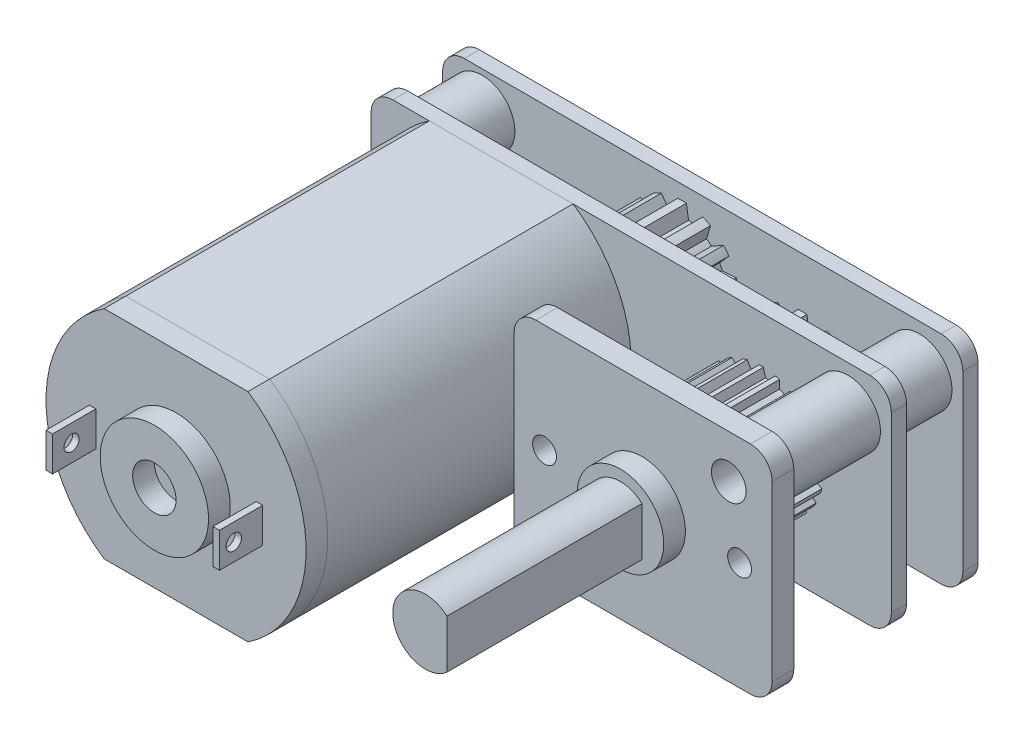
from build123d import *

# Parameters (mm, degrees)
EXTRUDE_1_DEPTH     = 14
EXTRUDE_2_DEPTH     = 1
SKETCH_3_R          = 2.5
SKETCH_3_R_2        = 1
EXTRUDE_3_DEPTH     = 1
SKETCH_4_W          = 0.3
SKETCH_4_H          = 1.6
EXTRUDE_4_DEPTH     = 2
EXTRUDE_4_2_DEPTH   = 2
SKETCH_5_R          = 0.35
CUT_EXTRUDE_1_DEPTH = 1
SKETCH_6_R          = 0.356116949
CUT_EXTRUDE_2_DEPTH = 1
EXTRUDE_5_DEPTH     = 0.7
EXTRUDE_6_DEPTH     = 2.5
SKETCH_9_R          = 1.5
EXTRUDE_7_DEPTH     = 2.6
EXTRUDE_8_DEPTH     = 0.7
SKETCH_11_R         = 1.5
SKETCH_11_R_2       = 0.8
EXTRUDE_9_DEPTH     = 9.5
EXTRUDE_15_DEPTH    = 4.5
SKETCH_13_R         = 0.8
EXTRUDE_12_DEPTH    = 1
SKETCH_14_R         = 2
EXTRUDE_13_DEPTH    = 1
EXTRUDE_14_DEPTH    = 9
EXTRUDE_16_DEPTH    = 2
EXTRUDE_16_2_DEPTH  = 2
SKETCH_19_R         = 0.55
CUT_EXTRUDE_3_DEPTH = 2


with BuildPart() as part:
    # 草图1 → 凸台-拉伸1 (new body)
    with BuildSketch(Plane.XY):
        with BuildLine():
            Line((-3.31662479, 5), (3.31662479, 5))
            ThreePointArc((3.31662479, 5), (6, 0), (3.31662479, -5))
            Line((3.31662479, -5), (-3.31662479, -5))
            ThreePointArc((-3.31662479, -5), (-6, 0), (-3.31662479, 5))
        make_face()
    extrude(amount=EXTRUDE_1_DEPTH)


with BuildPart() as body_2:
    # 草图2 → 凸台-拉伸2 (new body)
    with BuildSketch(Plane.XY.offset(14)):
        with BuildLine():
            Line((-3.31662479, -5), (3.31662479, -5))
            ThreePointArc((3.31662479, -5), (6, 0), (3.31662479, 5))
            Line((3.31662479, 5), (-3.31662479, 5))
            ThreePointArc((-3.31662479, 5), (-6, 0), (-3.31662479, -5))
        make_face()
    extrude(amount=EXTRUDE_2_DEPTH)

    # 草图3 → 凸台-拉伸3 (add)
    with BuildSketch(Plane.XY.offset(15)):
        Circle(SKETCH_3_R)
        Circle(SKETCH_3_R_2, mode=Mode.SUBTRACT)
    extrude(amount=EXTRUDE_3_DEPTH)


with BuildPart() as body_3:
    # 草图4 → 凸台-拉伸4 (new body)
    with BuildSketch(Plane.XY.offset(15)):
        with Locations((-3.85, 0)):
            Rectangle(SKETCH_4_W, SKETCH_4_H)
    extrude(amount=EXTRUDE_4_DEPTH)

    # 草图5 → 切除-拉伸1 (cut)
    with BuildSketch(Plane.ZY.offset(4)):
        with Locations((16.118929636, 0)):
            Circle(SKETCH_5_R)
    extrude(amount=-CUT_EXTRUDE_1_DEPTH, mode=Mode.SUBTRACT)


with BuildPart() as body_4:
    # 草图4 → Extrude 4 2 (new body)
    with BuildSketch(Plane.XY.offset(15)):
        with Locations((3.85, 0)):
            Rectangle(SKETCH_4_W, SKETCH_4_H)
    extrude(amount=EXTRUDE_4_2_DEPTH)

    # 草图6 → 切除-拉伸2 (cut)
    with BuildSketch(Plane(origin=(4, 0, 0), x_dir=(0, 0, -1), z_dir=(1, 0, 0))):
        with Locations((-16.333915557, 0)):
            Circle(SKETCH_6_R)
    extrude(amount=-CUT_EXTRUDE_2_DEPTH, mode=Mode.SUBTRACT)


with BuildPart() as body_5:
    # 草图7 → 凸台-拉伸5 (new body)
    with BuildSketch(Plane(origin=(0, 0, 0), x_dir=(-1, 0, 0), z_dir=(0, 0, -1))):
        with BuildLine():
            Line((-17, 5), (5, 5))
            ThreePointArc((5, 5), (5.707106781, 4.707106781), (6, 4))
            Line((6, 4), (6, -4))
            ThreePointArc((6, -4), (5.707106781, -4.707106781), (5, -5))
            Line((5, -5), (-17, -5))
            ThreePointArc((-17, -5), (-17.707106781, -4.707106781), (-18, -4))
            Line((-18, -4), (-18, 4))
            ThreePointArc((-18, 4), (-17.707106781, 4.707106781), (-17, 5))
        make_face()
    extrude(amount=EXTRUDE_5_DEPTH)

    # 草图8 → 凸台-拉伸6 (add)
    with BuildSketch(Plane(origin=(0, 0, -0.7), x_dir=(-1, 0, 0), z_dir=(0, 0, -1))):
        Polygon((0, 2.149770223), (0.171784211, 1.63441759), (0.446962362, 2.102792585), (0.507844838, 1.562985698), (0.874390324, 1.963912822), (0.821710209, 1.423243832), (1.263603233, 1.739200644), (1.099662901, 1.22129938), (1.597590617, 1.438477053), (1.329555048, 0.965978286), (1.861755625, 1.074885111), (1.501339259, 0.668439304), (2.044552979, 0.664315533), (1.60750774, 0.341686318), (2.137993556, 0.224712178), (1.643420419, 0), (2.137993556, -0.224712178), (1.60750774, -0.341686318), (2.044552979, -0.664315533), (1.501339259, -0.668439304), (1.861755625, -1.074885111), (1.329555048, -0.965978286), (1.597590617, -1.438477053), (1.099662901, -1.22129938), (1.263603233, -1.739200644), (0.821710209, -1.423243832), (0.874390324, -1.963912822), (0.507844838, -1.562985698), (0.446962362, -2.102792585), (0.171784211, -1.63441759), (0, -2.149770223), (-0.171784211, -1.63441759), (-0.446962362, -2.102792585), (-0.507844838, -1.562985698), (-0.874390324, -1.963912822), (-0.821710209, -1.423243832), (-1.263603233, -1.739200644), (-1.099662901, -1.22129938), (-1.597590617, -1.438477053), (-1.329555048, -0.965978286), (-1.861755625, -1.074885111), (-1.501339259, -0.668439304), (-2.044552979, -0.664315533), (-1.60750774, -0.341686318), (-2.137993556, -0.224712178), (-1.643420419, 0), (-2.137993556, 0.224712178), (-1.60750774, 0.341686318), (-2.044552979, 0.664315533), (-1.501339259, 0.668439304), (-1.861755625, 1.074885111), (-1.329555048, 0.965978286), (-1.597590617, 1.438477053), (-1.099662901, 1.22129938), (-1.263603233, 1.739200644), (-0.821710209, 1.423243832), (-0.874390324, 1.963912822), (-0.507844838, 1.562985698), (-0.446962362, 2.102792585), (-0.171784211, 1.63441759), align=None)
    extrude(amount=EXTRUDE_6_DEPTH)

    # 草图9 → 凸台-拉伸7 (add)
    with BuildSketch(Plane(origin=(0, 0, -0.7), x_dir=(-1, 0, 0), z_dir=(0, 0, -1))):
        with Locations((4.167110442, 3.247472276)):
            Circle(SKETCH_9_R)
        with Locations((-4.128792185, -3.266631404)):
            Circle(SKETCH_9_R)
    extrude(amount=EXTRUDE_7_DEPTH)

    # 草图10 → 凸台-拉伸8 (add)
    with BuildSketch(Plane(origin=(0, 0, -3.3), x_dir=(-1, 0, 0), z_dir=(0, 0, -1))):
        with BuildLine():
            Line((-17, 5), (5, 5))
            ThreePointArc((5, 5), (5.707106781, 4.707106781), (6, 4))
            Line((6, 4), (6, -4))
            ThreePointArc((6, -4), (5.707106781, -4.707106781), (5, -5))
            Line((5, -5), (-17, -5))
            ThreePointArc((-17, -5), (-17.707106781, -4.707106781), (-18, -4))
            Line((-18, -4), (-18, 4))
            ThreePointArc((-18, 4), (-17.707106781, 4.707106781), (-17, 5))
        make_face()
    extrude(amount=EXTRUDE_8_DEPTH)

    # 草图11 → 凸台-拉伸9 (add)
    # profile 1 of 2: a face of its own
    with BuildSketch(Plane(origin=(0, 0, -4), x_dir=(-1, 0, 0), z_dir=(0, 0, -1))):
        with Locations((-16, 3)):
            Circle(SKETCH_11_R)
        with Locations((-16, 3)):
            Circle(SKETCH_11_R_2, mode=Mode.SUBTRACT)
    # profile 2 of 2: a face of its own
    with BuildSketch(Plane(origin=(0, 0, -4), x_dir=(-1, 0, 0), z_dir=(0, 0, -1))):
        with Locations((-8, -3)):
            Circle(SKETCH_11_R)
        with Locations((-8, -3)):
            Circle(SKETCH_11_R_2, mode=Mode.SUBTRACT)
    extrude(amount=-EXTRUDE_9_DEPTH)

    # 草图13 → 凸台-拉伸12 (add)
    with BuildSketch(Plane.XY.offset(5.5)):
        with BuildLine():
            Line((7.1, 5), (17, 5))
            ThreePointArc((17, 5), (17.707106781, 4.707106781), (18, 4))
            Line((18, 4), (18, -4))
            ThreePointArc((18, -4), (17.707106781, -4.707106781), (17, -5))
            Line((17, -5), (7.1, -5))
            ThreePointArc((7.1, -5), (6.392893219, -4.707106781), (6.1, -4))
            Line((6.1, -4), (6.1, 4))
            ThreePointArc((6.1, 4), (6.392893219, 4.707106781), (7.1, 5))
        make_face()
        with Locations(Location((16, 3, 0), (0, 0, 180))):
            Circle(SKETCH_13_R, mode=Mode.SUBTRACT)
        with Locations(Location((8, -3, 0), (0, 0, 180))):
            Circle(SKETCH_13_R, mode=Mode.SUBTRACT)
    extrude(amount=-EXTRUDE_12_DEPTH)

    # 草图14 → 凸台-拉伸13 (add)
    with BuildSketch(Plane.XY.offset(5.5)):
        with Locations(Location((12, 0, 0), (0, 0, 180))):
            Circle(SKETCH_14_R)
    extrude(amount=EXTRUDE_13_DEPTH)

    # 草图19 → 切除-拉伸3 (cut)
    with BuildSketch(Plane.XY.offset(5.5)):
        with Locations((7.5, 0)):
            Circle(SKETCH_19_R)
        with Locations((16.5, 0)):
            Circle(SKETCH_19_R)
    extrude(amount=-CUT_EXTRUDE_3_DEPTH, mode=Mode.SUBTRACT)


with BuildPart() as body_6:
    # 草图17 → 凸台-拉伸15 (new body)
    with BuildSketch(Plane.XY):
        with BuildLine():
            Line((11.9, 2.864369692), (11.8, 2.491987159))
            ThreePointArc((11.8, 2.491987159), (11.673684519, 2.478612153), (11.548211428, 2.458838565))
            Line((11.548211428, 2.458838565), (11.355239154, 2.792650567))
            ThreePointArc((11.355239154, 2.792650567), (11.258194918, 2.768454254), (11.162053989, 2.740886758))
            Line((11.162053989, 2.740886758), (11.161841098, 2.355310947))
            ThreePointArc((11.161841098, 2.355310947), (11.043291419, 2.309698831), (10.927211501, 2.258124185))
            Line((10.927211501, 2.258124185), (10.654417694, 2.53061692))
            ThreePointArc((10.654417694, 2.53061692), (10.566942627, 2.48212818), (10.481212613, 2.43061692))
            Line((10.481212613, 2.43061692), (10.58080134, 2.058124185))
            ThreePointArc((10.58080134, 2.058124185), (10.478096427, 1.983383351), (10.379320338, 1.903522375))
            Line((10.379320338, 1.903522375), (10.045295445, 2.096125912))
            ThreePointArc((10.045295445, 2.096125912), (9.973350828, 2.026649172), (9.903874088, 1.954704555))
            Line((9.903874088, 1.954704555), (10.096477625, 1.620679662))
            ThreePointArc((10.096477625, 1.620679662), (10.016616649, 1.521903573), (9.941875815, 1.41919866))
            Line((9.941875815, 1.41919866), (9.56938308, 1.518787387))
            ThreePointArc((9.56938308, 1.518787387), (9.51787182, 1.433057373), (9.46938308, 1.345582306))
            Line((9.46938308, 1.345582306), (9.741875815, 1.072788499))
            ThreePointArc((9.741875815, 1.072788499), (9.690301169, 0.956708581), (9.644689053, 0.838158902))
            Line((9.644689053, 0.838158902), (9.259113242, 0.837946011))
            ThreePointArc((9.259113242, 0.837946011), (9.231545746, 0.741805082), (9.207349433, 0.644760846))
            Line((9.207349433, 0.644760846), (9.541161435, 0.451788572))
            ThreePointArc((9.541161435, 0.451788572), (9.521387847, 0.326315481), (9.508012841, 0.2))
            Line((9.508012841, 0.2), (9.135630308, 0.1))
            ThreePointArc((9.135630308, 0.1), (9.133885254, 0), (9.135630308, -0.1))
            Line((9.135630308, -0.1), (9.508012841, -0.2))
            ThreePointArc((9.508012841, -0.2), (9.521387847, -0.326315481), (9.541161435, -0.451788572))
            Line((9.541161435, -0.451788572), (9.207349433, -0.644760846))
            ThreePointArc((9.207349433, -0.644760846), (9.231545746, -0.741805082), (9.259113242, -0.837946011))
            Line((9.259113242, -0.837946011), (9.644689053, -0.838158902))
            ThreePointArc((9.644689053, -0.838158902), (9.690301169, -0.956708581), (9.741875815, -1.072788499))
            Line((9.741875815, -1.072788499), (9.46938308, -1.345582306))
            ThreePointArc((9.46938308, -1.345582306), (9.51787182, -1.433057373), (9.56938308, -1.518787387))
            Line((9.56938308, -1.518787387), (9.941875815, -1.41919866))
            ThreePointArc((9.941875815, -1.41919866), (10.016616649, -1.521903573), (10.096477625, -1.620679662))
            Line((10.096477625, -1.620679662), (9.903874088, -1.954704555))
            ThreePointArc((9.903874088, -1.954704555), (9.973350828, -2.026649172), (10.045295445, -2.096125912))
            Line((10.045295445, -2.096125912), (10.379320338, -1.903522375))
            ThreePointArc((10.379320338, -1.903522375), (10.478096427, -1.983383351), (10.58080134, -2.058124185))
            Line((10.58080134, -2.058124185), (10.481212613, -2.43061692))
            ThreePointArc((10.481212613, -2.43061692), (10.566942627, -2.48212818), (10.654417694, -2.53061692))
            Line((10.654417694, -2.53061692), (10.927211501, -2.258124185))
            ThreePointArc((10.927211501, -2.258124185), (11.043291419, -2.309698831), (11.161841098, -2.355310947))
            Line((11.161841098, -2.355310947), (11.162053989, -2.740886758))
            ThreePointArc((11.162053989, -2.740886758), (11.258194918, -2.768454254), (11.355239154, -2.792650567))
            Line((11.355239154, -2.792650567), (11.548211428, -2.458838565))
            ThreePointArc((11.548211428, -2.458838565), (11.673684519, -2.478612153), (11.8, -2.491987159))
            Line((11.8, -2.491987159), (11.9, -2.864369692))
            ThreePointArc((11.9, -2.864369692), (12, -2.866114746), (12.1, -2.864369692))
            Line((12.1, -2.864369692), (12.2, -2.491987159))
            ThreePointArc((12.2, -2.491987159), (12.326315481, -2.478612153), (12.451788572, -2.458838565))
            Line((12.451788572, -2.458838565), (12.644760846, -2.792650567))
            ThreePointArc((12.644760846, -2.792650567), (12.741805082, -2.768454254), (12.837946011, -2.740886758))
            Line((12.837946011, -2.740886758), (12.838158902, -2.355310947))
            ThreePointArc((12.838158902, -2.355310947), (12.956708581, -2.309698831), (13.072788499, -2.258124185))
            Line((13.072788499, -2.258124185), (13.345582306, -2.53061692))
            ThreePointArc((13.345582306, -2.53061692), (13.433057373, -2.48212818), (13.518787387, -2.43061692))
            Line((13.518787387, -2.43061692), (13.41919866, -2.058124185))
            ThreePointArc((13.41919866, -2.058124185), (13.521903573, -1.983383351), (13.620679662, -1.903522375))
            Line((13.620679662, -1.903522375), (13.954704555, -2.096125912))
            ThreePointArc((13.954704555, -2.096125912), (14.026649172, -2.026649172), (14.096125912, -1.954704555))
            Line((14.096125912, -1.954704555), (13.903522375, -1.620679662))
            ThreePointArc((13.903522375, -1.620679662), (13.983383351, -1.521903573), (14.058124185, -1.41919866))
            Line((14.058124185, -1.41919866), (14.43061692, -1.518787387))
            ThreePointArc((14.43061692, -1.518787387), (14.48212818, -1.433057373), (14.53061692, -1.345582306))
            Line((14.53061692, -1.345582306), (14.258124185, -1.072788499))
            ThreePointArc((14.258124185, -1.072788499), (14.309698831, -0.956708581), (14.355310947, -0.838158902))
            Line((14.355310947, -0.838158902), (14.740886758, -0.837946011))
            ThreePointArc((14.740886758, -0.837946011), (14.768454254, -0.741805082), (14.792650567, -0.644760846))
            Line((14.792650567, -0.644760846), (14.458838565, -0.451788572))
            ThreePointArc((14.458838565, -0.451788572), (14.478612153, -0.326315481), (14.491987159, -0.2))
            Line((14.491987159, -0.2), (14.864369692, -0.1))
            ThreePointArc((14.864369692, -0.1), (14.866114746, 0), (14.864369692, 0.1))
            Line((14.864369692, 0.1), (14.491987159, 0.2))
            ThreePointArc((14.491987159, 0.2), (14.478612153, 0.326315481), (14.458838565, 0.451788572))
            Line((14.458838565, 0.451788572), (14.792650567, 0.644760846))
            ThreePointArc((14.792650567, 0.644760846), (14.768454254, 0.741805082), (14.740886758, 0.837946011))
            Line((14.740886758, 0.837946011), (14.355310947, 0.838158902))
            ThreePointArc((14.355310947, 0.838158902), (14.309698831, 0.956708581), (14.258124185, 1.072788499))
            Line((14.258124185, 1.072788499), (14.53061692, 1.345582306))
            ThreePointArc((14.53061692, 1.345582306), (14.48212818, 1.433057373), (14.43061692, 1.518787387))
            Line((14.43061692, 1.518787387), (14.058124185, 1.41919866))
            ThreePointArc((14.058124185, 1.41919866), (13.983383351, 1.521903573), (13.903522375, 1.620679662))
            Line((13.903522375, 1.620679662), (14.096125912, 1.954704555))
            ThreePointArc((14.096125912, 1.954704555), (14.026649172, 2.026649172), (13.954704555, 2.096125912))
            Line((13.954704555, 2.096125912), (13.620679662, 1.903522375))
            ThreePointArc((13.620679662, 1.903522375), (13.521903573, 1.983383351), (13.41919866, 2.058124185))
            Line((13.41919866, 2.058124185), (13.518787387, 2.43061692))
            ThreePointArc((13.518787387, 2.43061692), (13.433057373, 2.48212818), (13.345582306, 2.53061692))
            Line((13.345582306, 2.53061692), (13.072788499, 2.258124185))
            ThreePointArc((13.072788499, 2.258124185), (12.956708581, 2.309698831), (12.838158902, 2.355310947))
            Line((12.838158902, 2.355310947), (12.837946011, 2.740886758))
            ThreePointArc((12.837946011, 2.740886758), (12.741805082, 2.768454254), (12.644760846, 2.792650567))
            Line((12.644760846, 2.792650567), (12.451788572, 2.458838565))
            ThreePointArc((12.451788572, 2.458838565), (12.326315481, 2.478612153), (12.2, 2.491987159))
            Line((12.2, 2.491987159), (12.1, 2.864369692))
            ThreePointArc((12.1, 2.864369692), (12, 2.866114746), (11.9, 2.864369692))
        make_face()
    extrude(amount=EXTRUDE_15_DEPTH)


with BuildPart() as body_7:
    # 草图15 → 凸台-拉伸14 (new body)
    with BuildSketch(Plane.XY.offset(6.5)):
        with BuildLine():
            Line((13, 1.118033989), (13, -1.118033989))
            ThreePointArc((13, -1.118033989), (10.5, 0), (13, 1.118033989))
        make_face()
    extrude(amount=EXTRUDE_14_DEPTH)


with BuildPart() as body_8:
    # 草图18 → 凸台-拉伸16 (new body)
    with BuildSketch(Plane.XY.offset(-3.3)):
        with BuildLine():
            Line((10.406620974, 2.677747688), (10.287123171, 1.960164279))
            ThreePointArc((10.287123171, 1.960164279), (10.086650913, 1.926008516), (9.889617991, 1.875671945))
            Line((9.889617991, 1.875671945), (9.488583849, 2.482612873))
            ThreePointArc((9.488583849, 2.482612873), (9.303512018, 2.407041528), (9.123514338, 2.320073454))
            Line((9.123514338, 2.320073454), (9.30621513, 1.615924256))
            ThreePointArc((9.30621513, 1.615924256), (9.136967009, 1.503182), (8.977442206, 1.377056745))
            Line((8.977442206, 1.377056745), (8.364214172, 1.768409592))
            ThreePointArc((8.364214172, 1.768409592), (8.225880277, 1.624096238), (8.096817316, 1.471435297))
            Line((8.096817316, 1.471435297), (8.550126076, 0.902474102))
            ThreePointArc((8.550126076, 0.902474102), (8.44136663, 0.730639514), (8.346933234, 0.550533777))
            Line((8.346933234, 0.550533777), (7.627544006, 0.658630082))
            ThreePointArc((7.627544006, 0.658630082), (7.559867233, 0.470527808), (7.50405515, 0.278570464))
            Line((7.50405515, 0.278570464), (8.149590675, -0.056824169))
            ThreePointArc((8.149590675, -0.056824169), (8.120125401, -0.258039328), (8.107111804, -0.460983628))
            Line((8.107111804, -0.460983628), (7.405950314, -0.6548347))
            ThreePointArc((7.405950314, -0.6548347), (7.420632593, -0.854201301), (7.447721804, -1.05226388))
            Line((7.447721804, -1.05226388), (8.173865138, -1.096099171))
            ThreePointArc((8.173865138, -1.096099171), (8.228788849, -1.291902972), (8.29944522, -1.482594922))
            Line((8.29944522, -1.482594922), (7.73774866, -1.944874759))
            ThreePointArc((7.73774866, -1.944874759), (7.832251291, -2.121033391), (7.937557825, -2.290954386))
            Line((7.937557825, -2.290954386), (8.618752188, -2.035650815))
            ThreePointArc((8.618752188, -2.035650815), (8.748568076, -2.192187002), (8.890677286, -2.337654232))
            Line((8.890677286, -2.337654232), (8.565568095, -2.98843045))
            ThreePointArc((8.565568095, -2.98843045), (8.723550715, -3.110921685), (8.888866116, -3.223320212))
            Line((8.888866116, -3.223320212), (9.407326814, -2.713022086))
            ThreePointArc((9.407326814, -2.713022086), (9.589588532, -2.80322413), (9.778578608, -2.878314034))
            Line((9.778578608, -2.878314034), (9.746271118, -3.605061514))
            ThreePointArc((9.746271118, -3.605061514), (9.940417096, -3.652705504), (10.137156829, -3.688146837))
            Line((10.137156829, -3.688146837), (10.403237298, -3.011089337))
            ThreePointArc((10.403237298, -3.011089337), (10.60643014, -3.019360486), (10.809622981, -3.011089337))
            Line((10.809622981, -3.011089337), (11.07570345, -3.688146837))
            ThreePointArc((11.07570345, -3.688146837), (11.272443183, -3.652705504), (11.466589162, -3.605061514))
            Line((11.466589162, -3.605061514), (11.434281671, -2.878314034))
            ThreePointArc((11.434281671, -2.878314034), (11.623271747, -2.80322413), (11.805533465, -2.713022086))
            Line((11.805533465, -2.713022086), (12.323994163, -3.223320212))
            ThreePointArc((12.323994163, -3.223320212), (12.489309565, -3.110921685), (12.647292185, -2.98843045))
            Line((12.647292185, -2.98843045), (12.322182993, -2.337654232))
            ThreePointArc((12.322182993, -2.337654232), (12.464292203, -2.192187002), (12.594108091, -2.035650815))
            Line((12.594108091, -2.035650815), (13.275302454, -2.290954386))
            ThreePointArc((13.275302454, -2.290954386), (13.380608988, -2.121033391), (13.475111619, -1.944874759))
            Line((13.475111619, -1.944874759), (12.91341506, -1.482594922))
            ThreePointArc((12.91341506, -1.482594922), (12.98407143, -1.291902972), (13.038995142, -1.096099171))
            Line((13.038995142, -1.096099171), (13.765138475, -1.05226388))
            ThreePointArc((13.765138475, -1.05226388), (13.792227686, -0.854201301), (13.806909965, -0.6548347))
            Line((13.806909965, -0.6548347), (13.105748475, -0.460983628))
            ThreePointArc((13.105748475, -0.460983628), (13.092734878, -0.258039328), (13.063269604, -0.056824169))
            Line((13.063269604, -0.056824169), (13.708805129, 0.278570464))
            ThreePointArc((13.708805129, 0.278570464), (13.652993046, 0.470527808), (13.585316274, 0.658630082))
            Line((13.585316274, 0.658630082), (12.865927045, 0.550533777))
            ThreePointArc((12.865927045, 0.550533777), (12.771493649, 0.730639514), (12.662734204, 0.902474102))
            Line((12.662734204, 0.902474102), (13.116042964, 1.471435297))
            ThreePointArc((13.116042964, 1.471435297), (12.986980002, 1.624096238), (12.848646107, 1.768409592))
            Line((12.848646107, 1.768409592), (12.235418073, 1.377056745))
            ThreePointArc((12.235418073, 1.377056745), (12.07589327, 1.503182), (11.90664515, 1.615924256))
            Line((11.90664515, 1.615924256), (12.089345941, 2.320073454))
            ThreePointArc((12.089345941, 2.320073454), (11.909348261, 2.407041528), (11.72427643, 2.482612873))
            Line((11.72427643, 2.482612873), (11.323242288, 1.875671945))
            ThreePointArc((11.323242288, 1.875671945), (11.126209367, 1.926008516), (10.925737108, 1.960164279))
            Line((10.925737108, 1.960164279), (10.806239305, 2.677747688))
            ThreePointArc((10.806239305, 2.677747688), (10.60643014, 2.683985324), (10.406620974, 2.677747688))
        make_face()
    extrude(amount=EXTRUDE_16_DEPTH)


with BuildPart() as body_9:
    # 草图18 → Extrude 16 2 (new body)
    with BuildSketch(Plane.XY.offset(-3.3)):
        with BuildLine():
            Line((4.847273907, 4.340816673), (4.743796497, 3.711556337))
            ThreePointArc((4.743796497, 3.711556337), (4.600800942, 3.68435171), (4.460162753, 3.646818786))
            Line((4.460162753, 3.646818786), (4.093907, 4.168865593))
            ThreePointArc((4.093907, 4.168865593), (3.911725354, 4.089515048), (3.736098202, 3.996553957))
            Line((3.736098202, 3.996553957), (3.915894104, 3.384712818))
            ThreePointArc((3.915894104, 3.384712818), (3.798863206, 3.298158851), (3.688437502, 3.203322231))
            Line((3.688437502, 3.203322231), (3.13194485, 3.514757737))
            ThreePointArc((3.13194485, 3.514757737), (3.00223377, 3.364219712), (2.884333479, 3.204262898))
            Line((2.884333479, 3.204262898), (3.311791911, 2.731023598))
            ThreePointArc((3.311791911, 2.731023598), (3.243905074, 2.602263364), (3.18556302, 2.468906605))
            Line((3.18556302, 2.468906605), (2.549053664, 2.508047187))
            ThreePointArc((2.549053664, 2.508047187), (2.49750402, 2.316137585), (2.460682188, 2.120866456))
            Line((2.460682188, 2.120866456), (3.051139765, 1.879959843))
            ThreePointArc((3.051139765, 1.879959843), (3.04584281, 1.734495886), (3.051139765, 1.589031929))
            Line((3.051139765, 1.589031929), (2.460682188, 1.348125316))
            ThreePointArc((2.460682188, 1.348125316), (2.49750402, 1.152854187), (2.549053664, 0.960944585))
            Line((2.549053664, 0.960944585), (3.18556302, 1.000085167))
            ThreePointArc((3.18556302, 1.000085167), (3.243905074, 0.866728408), (3.311791911, 0.737968174))
            Line((3.311791911, 0.737968174), (2.884333479, 0.264728874))
            ThreePointArc((2.884333479, 0.264728874), (3.00223377, 0.10477206), (3.13194485, -0.045765965))
            Line((3.13194485, -0.045765965), (3.688437502, 0.265669541))
            ThreePointArc((3.688437502, 0.265669541), (3.798863206, 0.170832921), (3.915894104, 0.084278954))
            Line((3.915894104, 0.084278954), (3.736098202, -0.527562185))
            ThreePointArc((3.736098202, -0.527562185), (3.911725354, -0.620523276), (4.093907, -0.699873821))
            Line((4.093907, -0.699873821), (4.460162753, -0.177827013))
            ThreePointArc((4.460162753, -0.177827013), (4.600800942, -0.215359938), (4.743796497, -0.242564564))
            Line((4.743796497, -0.242564564), (4.847273907, -0.871824901))
            ThreePointArc((4.847273907, -0.871824901), (5.04584281, -0.879378184), (5.244411712, -0.871824901))
            Line((5.244411712, -0.871824901), (5.347889123, -0.242564564))
            ThreePointArc((5.347889123, -0.242564564), (5.490884678, -0.215359938), (5.631522866, -0.177827013))
            Line((5.631522866, -0.177827013), (5.997778619, -0.699873821))
            ThreePointArc((5.997778619, -0.699873821), (6.179960265, -0.620523276), (6.355587417, -0.527562185))
            Line((6.355587417, -0.527562185), (6.175791515, 0.084278954))
            ThreePointArc((6.175791515, 0.084278954), (6.292822413, 0.170832921), (6.403248117, 0.265669541))
            Line((6.403248117, 0.265669541), (6.959740769, -0.045765965))
            ThreePointArc((6.959740769, -0.045765965), (7.089451849, 0.10477206), (7.20735214, 0.264728874))
            Line((7.20735214, 0.264728874), (6.779893708, 0.737968174))
            ThreePointArc((6.779893708, 0.737968174), (6.847780545, 0.866728408), (6.906122599, 1.000085167))
            Line((6.906122599, 1.000085167), (7.542631956, 0.960944585))
            ThreePointArc((7.542631956, 0.960944585), (7.5941816, 1.152854187), (7.631003431, 1.348125316))
            Line((7.631003431, 1.348125316), (7.040545855, 1.589031929))
            ThreePointArc((7.040545855, 1.589031929), (7.04584281, 1.734495886), (7.040545855, 1.879959843))
            Line((7.040545855, 1.879959843), (7.631003431, 2.120866456))
            ThreePointArc((7.631003431, 2.120866456), (7.5941816, 2.316137585), (7.542631956, 2.508047187))
            Line((7.542631956, 2.508047187), (6.906122599, 2.468906605))
            ThreePointArc((6.906122599, 2.468906605), (6.847780545, 2.602263364), (6.779893708, 2.731023598))
            Line((6.779893708, 2.731023598), (7.20735214, 3.204262898))
            ThreePointArc((7.20735214, 3.204262898), (7.089451849, 3.364219712), (6.959740769, 3.514757737))
            Line((6.959740769, 3.514757737), (6.403248117, 3.203322231))
            ThreePointArc((6.403248117, 3.203322231), (6.292822413, 3.298158851), (6.175791515, 3.384712818))
            Line((6.175791515, 3.384712818), (6.355587417, 3.996553957))
            ThreePointArc((6.355587417, 3.996553957), (6.179960265, 4.089515048), (5.997778619, 4.168865593))
            Line((5.997778619, 4.168865593), (5.631522866, 3.646818786))
            ThreePointArc((5.631522866, 3.646818786), (5.490884678, 3.68435171), (5.347889123, 3.711556337))
            Line((5.347889123, 3.711556337), (5.244411712, 4.340816673))
            ThreePointArc((5.244411712, 4.340816673), (5.04584281, 4.348369956), (4.847273907, 4.340816673))
        make_face()
    extrude(amount=EXTRUDE_16_2_DEPTH)


solid = Compound([part.part, body_2.part, body_3.part, body_4.part, body_5.part, body_6.part, body_7.part, body_8.part, body_9.part])
